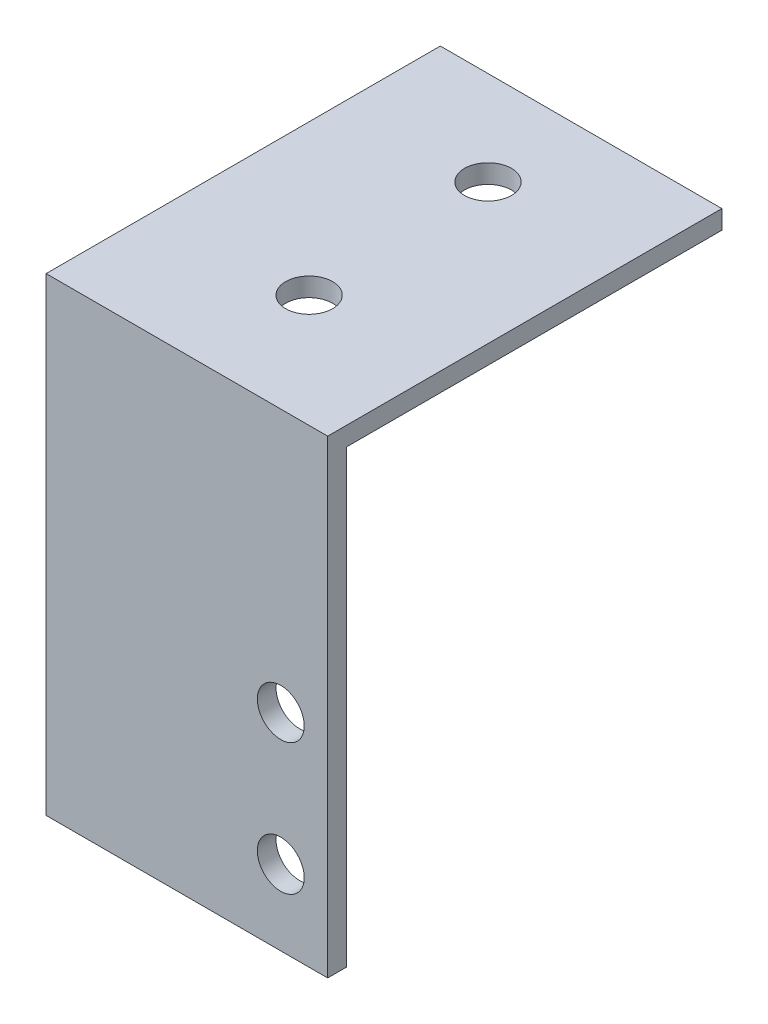
from build123d import *

# Parameters (mm, degrees)
SKETCH_1_W      = 15
SKETCH_1_H      = 25
EXTRUDE_1_DEPTH = 1
M3X0_5_1_D      = 2.5
M3X0_5_1_DEPTH  = 8.5
M3X0_5_1_TIP    = 0.751075774
SKETCH_4_W      = 15
SKETCH_4_H      = 1
EXTRUDE_2_DEPTH = 20
M3X0_5_2_D      = 2.5
M3X0_5_2_DEPTH  = 8.5
M3X0_5_2_TIP    = 0.751075774


with BuildPart() as part:
    # ｽｹｯﾁ1 → ﾎﾞｽ - 押し出し1 (new body)
    with BuildSketch(Plane.XY):
        with Locations((7.5, 12.5)):
            Rectangle(SKETCH_1_W, SKETCH_1_H)
    extrude(amount=EXTRUDE_1_DEPTH)

    # M3x0.5 ねじ穴1
    with Locations(Plane(origin=(0, 0, 0), x_dir=(-1, 0, 0), z_dir=(0, 0, -1))):
        with Locations((-12.5, 11), (-12.5, 4)):
            Hole(M3X0_5_1_D / 2, depth=M3X0_5_1_DEPTH)
            with Locations((0, 0, -(M3X0_5_1_DEPTH + M3X0_5_1_TIP / 2))):  # 118° drill point
                Cone(0, M3X0_5_1_D / 2, M3X0_5_1_TIP, mode=Mode.SUBTRACT)

    # ｽｹｯﾁ4 → ﾎﾞｽ - 押し出し2 (add)
    with BuildSketch(Plane(origin=(0, 0, 0), x_dir=(-1, 0, 0), z_dir=(0, 0, -1))):
        with Locations((-7.5, 24.5)):
            Rectangle(SKETCH_4_W, SKETCH_4_H)
    extrude(amount=EXTRUDE_2_DEPTH)

    # M3x0.5 ねじ穴2
    with Locations(Plane(origin=(0, 24, 0), x_dir=(-1, 0, 0), z_dir=(0, -1, 0))):
        with Locations((-8, 5.010585189), (-7.540008994, 15)):
            Hole(M3X0_5_2_D / 2, depth=M3X0_5_2_DEPTH)
            with Locations((0, 0, -(M3X0_5_2_DEPTH + M3X0_5_2_TIP / 2))):  # 118° drill point
                Cone(0, M3X0_5_2_D / 2, M3X0_5_2_TIP, mode=Mode.SUBTRACT)


solid = part.part
